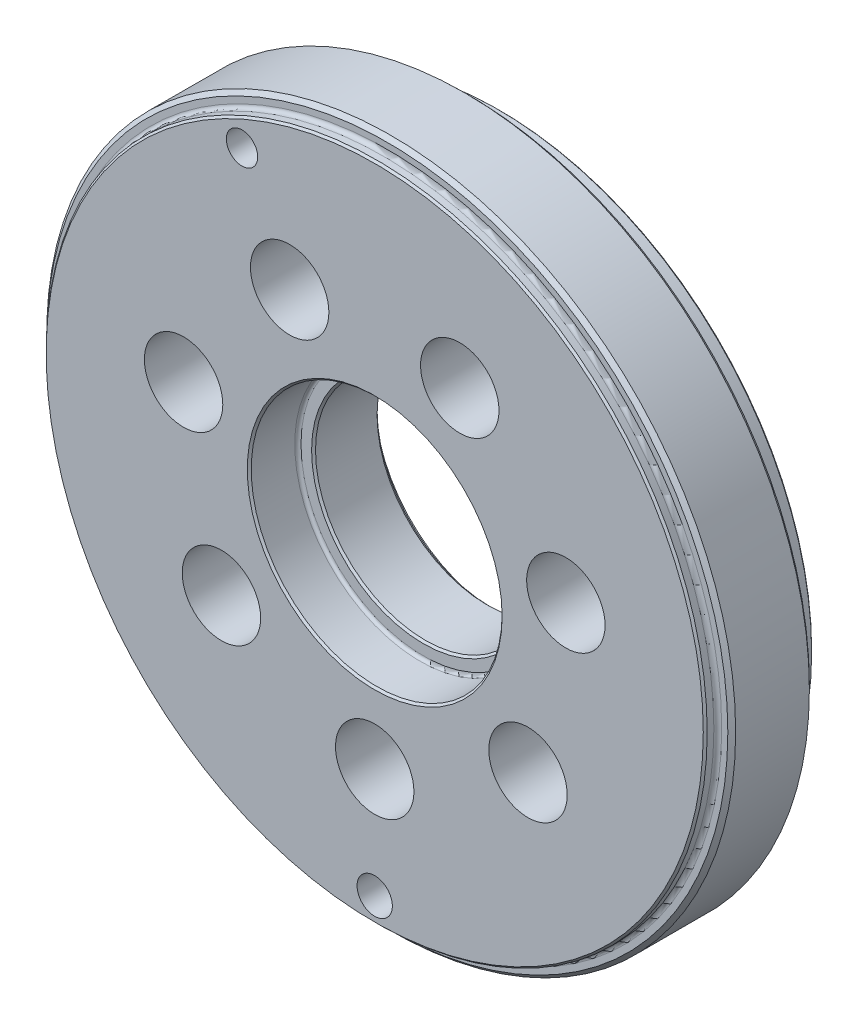
from build123d import *

# Parameters (mm, degrees)
SKETCH1_R                      = 43.93
SKETCH1_R_2                    = 14
EXTRUDE1_DEPTH                 = 16
EXTRUDE7_DEPTH                 = 2
CUT_EXTRUDE5_DEPTH             = 0.6
CIRPATTERN3_COUNT              = 7
EXTRUDE8_REACH                 = 65.684
SKETCH10_R                     = 5
CIRPATTERN2_COUNT              = 7
F_4_0_4_DIAMETER_HOLE1_D       = 4
F_4_0_4_DIAMETER_HOLE1_DEPTH   = 6
F_4_0_4_DIAMETER_HOLE1_TIP     = 1.201721238
F_4_5_4_5_DIAMETER_HOLE2_D     = 4.5
F_4_5_4_5_DIAMETER_HOLE2_DEPTH = 13.5
F_4_5_4_5_DIAMETER_HOLE2_TIP   = 1.351936393
CHAMFER1_SIZE                  = 0.5


with BuildPart() as part:
    # Sketch1 → Extrude1 (new body)
    with BuildSketch(Plane.XY):
        Circle(SKETCH1_R)
        Circle(SKETCH1_R_2, mode=Mode.SUBTRACT)
    extrude(amount=-EXTRUDE1_DEPTH)

    # Sketch13 → Cut-Revolve1 (revolve, cut)
    with BuildSketch(Plane(origin=(0, 0, 0), x_dir=(0, 0, -1), z_dir=(1, 0, 0)), mode=Mode.PRIVATE) as cut_revolve1_sk:
        with BuildLine():
            Line((5.8, 16), (0.25, 16))
            Line((0.25, 16), (0, 16.25))
            Line((0, 16.25), (0, 41.9))
            Line((0, 41.9), (0.25, 42.15))
            Line((0.25, 42.15), (1.1, 42.15))
            ThreePointArc((1.1, 42.15), (1.453553391, 42.296446609), (1.6, 42.65))
            Line((1.6, 42.65), (1.6, 50.047434563))
            Line((1.6, 50.047434563), (-4.843089059, 50.047434563))
            Line((-4.843089059, 50.047434563), (-4.843089059, 0))
            Line((-4.843089059, 0), (0, 0))
            Line((0, 0), (19.04869502, 0))
            Line((19.04869502, 0), (19.04869502, 50.047434563))
            Line((19.04869502, 50.047434563), (12, 50.047434563))
            Line((12, 50.047434563), (12, 40.37))
            ThreePointArc((12, 40.37), (12.117157288, 40.087157288), (12.4, 39.97))
            Line((12.4, 39.97), (15.75, 39.97))
            Line((15.75, 39.97), (16, 39.72))
            Line((16, 39.72), (16, 16))
            Line((16, 16), (15.2, 16))
            ThreePointArc((15.2, 16), (14.917157288, 15.882842712), (14.8, 15.6))
            Line((14.8, 15.6), (14.8, 14.5))
            Line((14.8, 14.5), (14.3, 14))
            Line((14.3, 14), (6.45, 14))
            Line((6.45, 14), (6.2, 14.25))
            Line((6.2, 14.25), (6.2, 15.6))
            ThreePointArc((6.2, 15.6), (6.082842712, 15.882842712), (5.8, 16))
        make_face()
    revolve(cut_revolve1_sk.sketch.rotate(Axis((0, 0, 0), (0, 0, -1)), 90), axis=Axis((0, 0, 0), (0, 0, -1)), mode=Mode.SUBTRACT)

    # Sketch9 → Extrude7 (cut)
    with BuildSketch(Plane(origin=(0, 0, -16), x_dir=(-1, 0, 0), z_dir=(0, 0, -1))):
        with BuildLine():
            Line((-3, -23), (-3, -27))
            ThreePointArc((-3, -27), (0, -30), (3, -27))
            Line((3, -27), (3, -23))
            ThreePointArc((3, -23), (0, -20), (-3, -23))
        make_face()
    extrude7 = extrude(amount=-EXTRUDE7_DEPTH, mode=Mode.SUBTRACT)

    # Sketch18 → Cut-Extrude5 (cut)
    with BuildSketch(Plane(origin=(0, 0, -16), x_dir=(-1, 0, 0), z_dir=(0, 0, -1))):
        with BuildLine():
            Line((12.682232603, -19.420632744), (14.41776756, -23.024508216))
            ThreePointArc((14.41776756, -23.024508216), (13.016512174, -27.029066037), (9.011954352, -25.627810651))
            Line((9.011954352, -25.627810651), (7.276419396, -22.023935179))
            ThreePointArc((7.276419396, -22.023935179), (8.677674782, -18.019377358), (12.682232603, -19.420632744))
        make_face()
    cut_extrude5 = extrude(amount=-CUT_EXTRUDE5_DEPTH, mode=Mode.SUBTRACT)

    # CirPattern3: Cut-Extrude5 ×7 about axis
    cirpattern3_axis = Axis((0, 0, 0), (0, 0, 1))
    for i in range(1, CIRPATTERN3_COUNT):
        add(cut_extrude5.rotate(cirpattern3_axis, i * 360 / CIRPATTERN3_COUNT), mode=Mode.SUBTRACT)

    # Sketch10 → Extrude8 (cut, up to next)
    with BuildSketch(Plane(origin=(0, 0, -14), x_dir=(-1, 0, 0), z_dir=(0, 0, -1)), mode=Mode.PRIVATE) as extrude8_sk1:
        with Locations(Location((0, -25, 0), (0, 0, 270))):
            Circle(SKETCH10_R)
    extrude8_tool1 = extrude(extrude8_sk1.sketch, amount=-EXTRUDE8_REACH, mode=Mode.PRIVATE) & part.part
    extrude8 = extrude8_tool1.solids().sort_by_distance((0, -25, -14))[0]
    add(extrude8, mode=Mode.SUBTRACT)

    # CirPattern2: Extrude7, Extrude8 ×7 about axis
    cirpattern2_axis = Axis((0, 0, 0), (0, 0, 1))
    add([extrude7.rotate(cirpattern2_axis, i * 360 / CIRPATTERN2_COUNT) for i in range(1, CIRPATTERN2_COUNT)], mode=Mode.SUBTRACT)
    add([extrude8.rotate(cirpattern2_axis, i * 360 / CIRPATTERN2_COUNT) for i in range(1, CIRPATTERN2_COUNT)], mode=Mode.SUBTRACT)

    # Ø4.0 (4) Diameter Hole1
    with Locations(Plane.XY):
        with Locations((-16.921465826, 35.137785848)):
            Hole(F_4_0_4_DIAMETER_HOLE1_D / 2, depth=F_4_0_4_DIAMETER_HOLE1_DEPTH)
            with Locations((0, 0, -(F_4_0_4_DIAMETER_HOLE1_DEPTH + F_4_0_4_DIAMETER_HOLE1_TIP / 2))):  # 118° drill point
                Cone(0, F_4_0_4_DIAMETER_HOLE1_D / 2, F_4_0_4_DIAMETER_HOLE1_TIP, mode=Mode.SUBTRACT)

    # Ø4.5 (4.5) Diameter Hole2
    with Locations(Plane.XY):
        with Locations((0, -39)):
            Hole(F_4_5_4_5_DIAMETER_HOLE2_D / 2, depth=F_4_5_4_5_DIAMETER_HOLE2_DEPTH)
            with Locations((0, 0, -(F_4_5_4_5_DIAMETER_HOLE2_DEPTH + F_4_5_4_5_DIAMETER_HOLE2_TIP / 2))):  # 118° drill point
                Cone(0, F_4_5_4_5_DIAMETER_HOLE2_D / 2, F_4_5_4_5_DIAMETER_HOLE2_TIP, mode=Mode.SUBTRACT)

    # Chamfer1
    chamfer1_edges = [part.edges().sort_by_distance(p)[0] for p in [
        (-43.93, 0, -12),
        (-43.93, 0, -1.6),
    ]]
    chamfer(chamfer1_edges, length=CHAMFER1_SIZE)


solid = part.part
